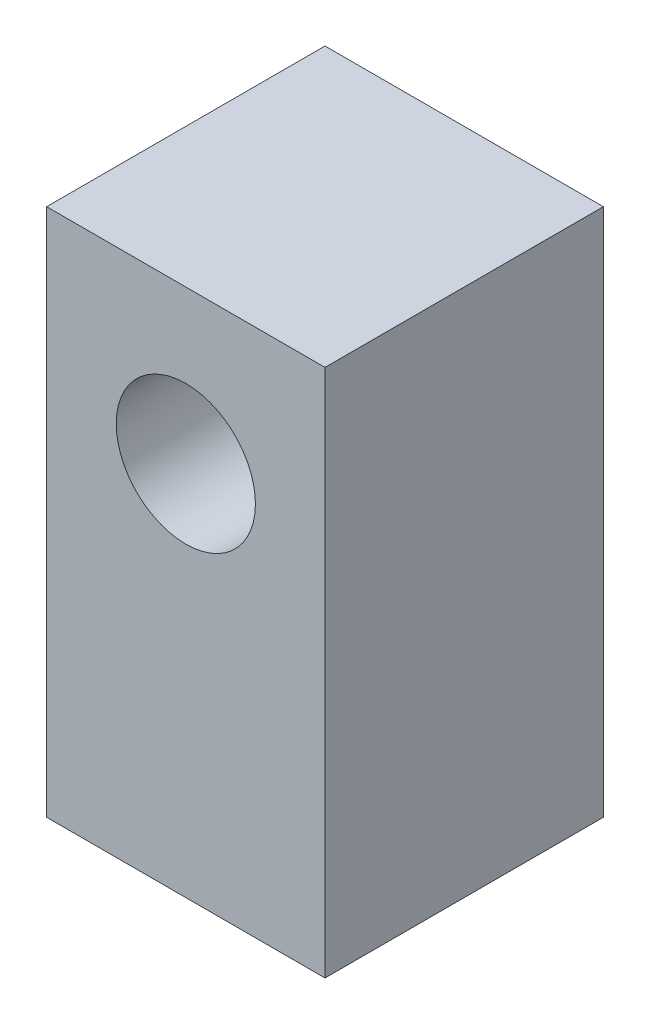
from build123d import *

# Parameters (mm, degrees)
SKETCH_1_W          = 10
SKETCH_1_H          = 19
EXTRUDE_1_DEPTH     = 10
SKETCH_2_R          = 2.5
CUT_EXTRUDE_1_DEPTH = 10


with BuildPart() as part:
    # Эскиз1 → Бобышка-Вытянуть1 (new body)
    with BuildSketch(Plane.XY):
        with Locations((5, 9.5)):
            Rectangle(SKETCH_1_W, SKETCH_1_H)
    extrude(amount=EXTRUDE_1_DEPTH)

    # Эскиз2 → Вырез-Вытянуть1 (cut)
    with BuildSketch(Plane(origin=(0, 0, 0), x_dir=(-1, 0, 0), z_dir=(0, 0, -1))):
        with Locations((-5, 13.5)):
            Circle(SKETCH_2_R)
    extrude(amount=-CUT_EXTRUDE_1_DEPTH, mode=Mode.SUBTRACT)


solid = part.part
